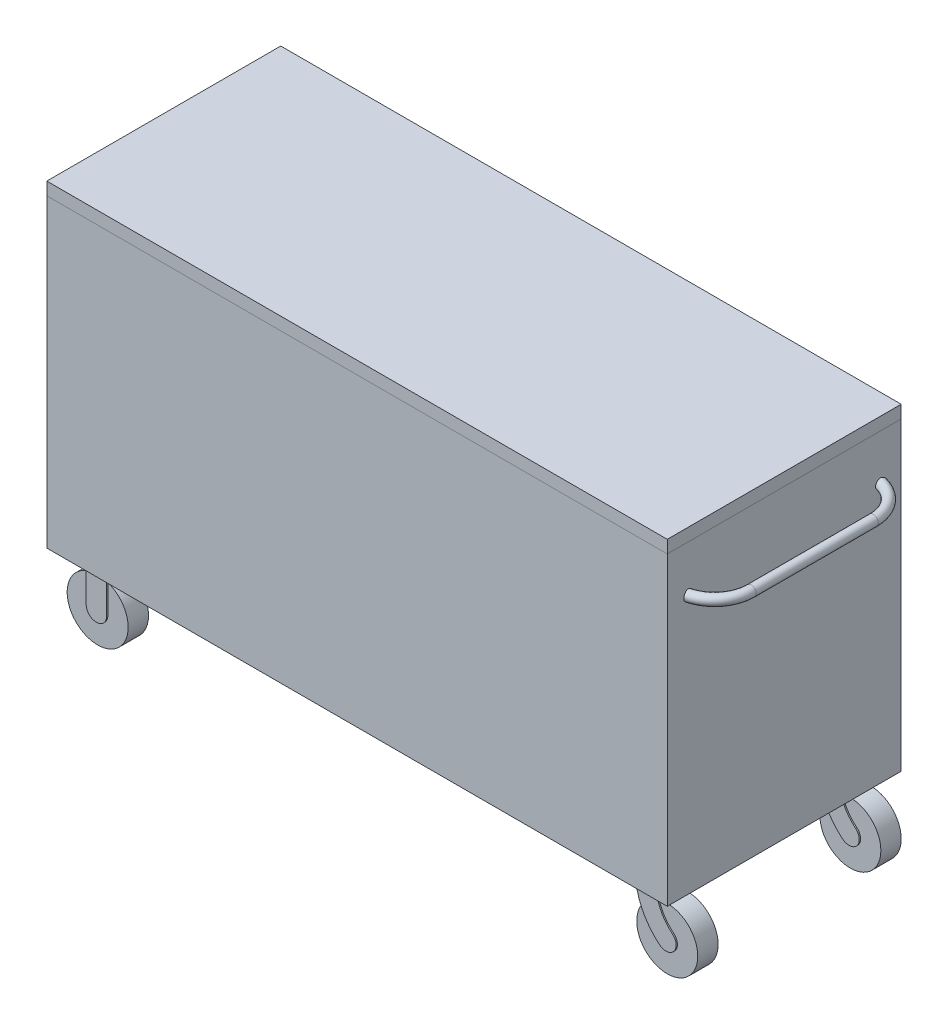
from build123d import *

# Parameters (mm, degrees)
SKETCH1_W             = 1549.4
SKETCH1_H             = 584.2
BOSS_EXTRUDE1_DEPTH   = 31.75
SKETCH2_W             = 1549.4
SKETCH2_H             = 584.2
BOSS_EXTRUDE2_DEPTH   = 762
SWEEP1_PROFILE_R      = 12.7
SKETCH13_R            = 76.2
BOSS_EXTRUDE3_DEPTH   = 25.4
BOSS_EXTRUDE3_2_DEPTH = 25.4
BOSS_EXTRUDE4_DEPTH   = 3.175


with BuildPart() as part:
    # Sketch1 → Boss-Extrude1 (new body)
    with BuildSketch(Plane(origin=(0, 0, 0), x_dir=(1, 0, 0), z_dir=(0, 1, 0))):
        Rectangle(SKETCH1_W, SKETCH1_H)
    extrude(amount=-BOSS_EXTRUDE1_DEPTH)


with BuildPart() as body_2:
    # Sketch2 → Boss-Extrude2 (new body)
    with BuildSketch(Plane.XZ.offset(31.75)):
        Rectangle(SKETCH2_W, SKETCH2_H)
    extrude(amount=BOSS_EXTRUDE2_DEPTH)

    # Sweep1: sweep along a path in Sketch3
    with BuildLine(Plane(origin=(0, -146.05, 0), x_dir=(1, 0, 0), z_dir=(0, 1, 0))) as sweep1_path:
        ThreePointArc((774.7, -241.3), (824.998613642, -208.929267862), (844.55, -152.4))
        Line((844.55, -152.4), (844.55, 152.4))
        ThreePointArc((844.55, 152.4), (824.998613642, 208.929267862), (774.7, 241.3))
    # Sweep1 profile (on start of the path) → Sweep1 (sweep)
    with BuildSketch(Plane(origin=(774.7, -146.05, 241.3), x_dir=(0.2365930599369072, 0, 0.9716088328075714), z_dir=(0.9716088328075714, 0, -0.2365930599369072))):
        Circle(SWEEP1_PROFILE_R)
    sweep(path=sweep1_path.line)


with BuildPart() as body_3:
    # Sketch13 → Boss-Extrude3 (new, symmetric)
    with BuildSketch(Plane.XY.offset(228.6)):
        with Locations((736.6, -901.7)):
            Circle(SKETCH13_R)
    extrude(amount=BOSS_EXTRUDE3_DEPTH, both=True)



with BuildPart() as body_4:
    # Sketch13 → Boss-Extrude3 2 (new, symmetric)
    with BuildSketch(Plane.XY.offset(228.6)):
        with Locations((-685.8, -901.7)):
            Circle(SKETCH13_R)
    extrude(amount=BOSS_EXTRUDE3_2_DEPTH, both=True)


with BuildPart() as body_3_1:
    add(body_3.part)

    add(body_4.part)  # Boss-Extrude4 merges body 4
    # Sketch14 → Boss-Extrude4 (add, symmetric)
    with BuildSketch(Plane.XY.offset(254)):
        with BuildLine():
            Line((-711.2, -793.75), (-660.4, -793.75))
            Line((-660.4, -793.75), (-660.4, -901.7))
            ThreePointArc((-660.4, -901.7), (-685.8, -927.1), (-711.2, -901.7))
            Line((-711.2, -901.7), (-711.2, -793.75))
        make_face()
        with BuildLine():
            Line((660.4, -793.75), (711.2, -793.75))
            ThreePointArc((711.2, -793.75), (722.116997416, -842.587589451), (752.7898017, -882.128328612))
            ThreePointArc((752.7898017, -882.128328612), (756.171671388, -917.8898017), (720.4101983, -921.271671388))
            ThreePointArc((720.4101983, -921.271671388), (676.152207344, -864.218078897), (660.4, -793.75))
        make_face()
    boss_extrude4 = extrude(amount=BOSS_EXTRUDE4_DEPTH, both=True)

    # Mirror1: Boss-Extrude4 across plane
    add(boss_extrude4.mirror(Plane.XY.offset(228.6)))


with BuildPart() as body_4_2:
    # Mirror2: mirrored copy
    add(body_3_1.part.mirror(Plane.XY))


solid = Compound([part.part, body_2.part, body_3_1.part, body_4_2.part])
